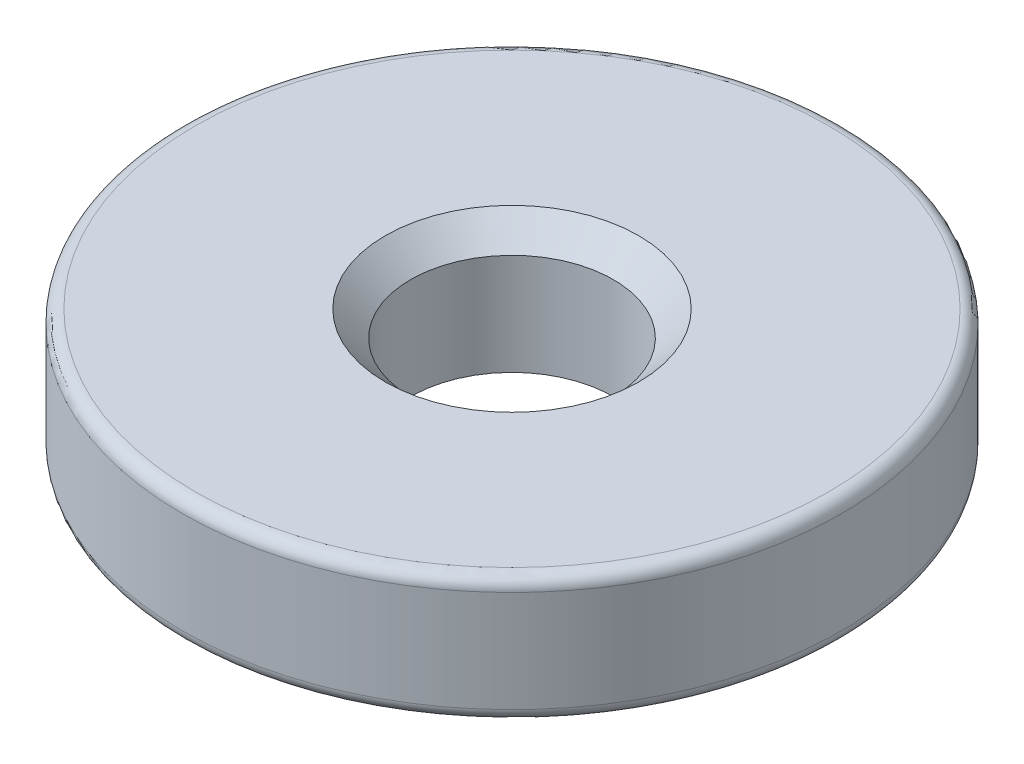
from build123d import *

# Parameters (mm, degrees)
SKETCH1_R           = 13
SKETCH1_R_2         = 4
BOSS_EXTRUDE1_DEPTH = 5
CHAMFER1_SIZE       = 1
FILLET1_R           = 0.5


with BuildPart() as part:
    # Sketch1 → Boss-Extrude1 (new body)
    with BuildSketch(Plane(origin=(0, 0, 0), x_dir=(1, 0, 0), z_dir=(0, 1, 0))):
        with Locations(Location((0, 0, 0), (0, 0, 270))):
            Circle(SKETCH1_R)
        with Locations(Location((0, 0, 0), (0, 0, 270))):
            Circle(SKETCH1_R_2, mode=Mode.SUBTRACT)
    extrude(amount=BOSS_EXTRUDE1_DEPTH)

    # Chamfer1
    chamfer1_edges = [part.edges().sort_by_distance(p)[0] for p in [
        (0, 5, -4),
    ]]
    chamfer(chamfer1_edges, length=CHAMFER1_SIZE)

    # Fillet1
    fillet1_edges = [part.edges().sort_by_distance(p)[0] for p in [
        (0, 0, -13),
        (0, 5, -13),
    ]]
    fillet(fillet1_edges, radius=FILLET1_R)


solid = part.part
